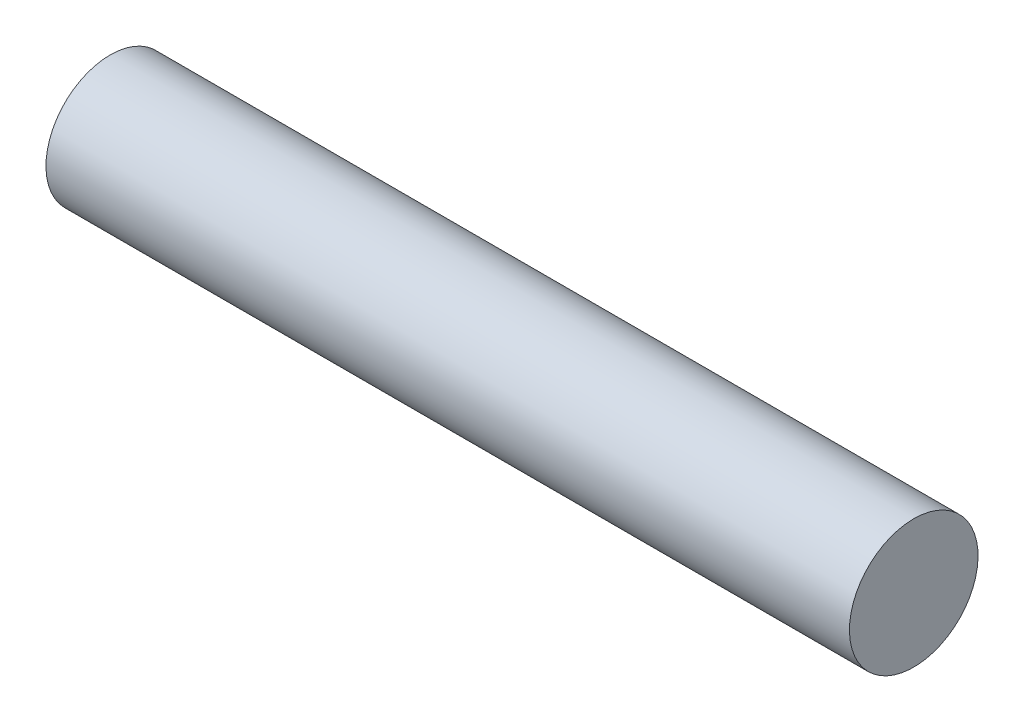
from build123d import *

# Parameters (mm, degrees)
SKETCH1_W = 175
SKETCH1_H = 14


with BuildPart() as part:
    # Sketch1 → Revolve2 (revolve)
    with BuildSketch(Plane.XY):
        with Locations((-87.5, -7)):
            Rectangle(SKETCH1_W, SKETCH1_H)
    revolve(axis=Axis((0, -14, 0), (-1, 0, 0)))


solid = part.part
